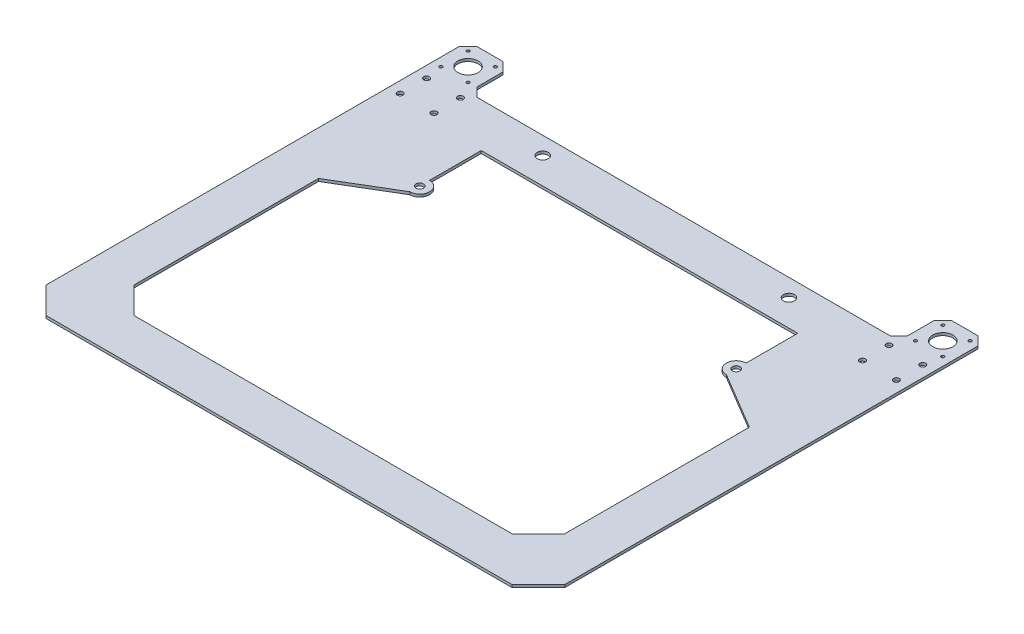
from build123d import *

# Parameters (mm, degrees)
SKETCH1_R           = 6.25
SKETCH1_R_2         = 4.25
SKETCH1_R_3         = 3.25
SKETCH1_R_4         = 11.5
SKETCH1_R_5         = 1.75
BOSS_EXTRUDE1_DEPTH = 3
SKETCH2_W           = 50
SKETCH2_H           = 50
SKETCH2_R           = 11.5
SKETCH2_R_2         = 1.75
BOSS_EXTRUDE2_DEPTH = 3
CHAMFER1_SIZE       = 10
CHAMFER2_SIZE       = 30


with BuildPart() as part:
    # Sketch1 → Boss-Extrude1 (new body)
    with BuildSketch(Plane(origin=(0, 0, 0), x_dir=(1, 0, 0), z_dir=(0, 1, 0))):
        Polygon((-245, 230), (295, 230), (295, -230), (-295, -230), (-295, 230), (-295, 280), (-245, 280), align=None)
        with Locations(Location((-140, 210, 0), (0, 0, 270))):
            Circle(SKETCH1_R, mode=Mode.SUBTRACT)
        with Locations(Location((140, 210, 0), (0, 0, 270))):
            Circle(SKETCH1_R, mode=Mode.SUBTRACT)
        with Locations(Location((-180, 110, 0), (0, 0, 270))):
            Circle(SKETCH1_R_2, mode=Mode.SUBTRACT)
        with Locations(Location((180, 110, 0), (0, 0, 270))):
            Circle(SKETCH1_R_2, mode=Mode.SUBTRACT)
        with Locations(Location((243.695652174, 220, 0), (0, 0, 270))):
            Circle(SKETCH1_R_3, mode=Mode.SUBTRACT)
        with Locations(Location((282.173913043, 220, 0), (0, 0, 270))):
            Circle(SKETCH1_R_3, mode=Mode.SUBTRACT)
        with Locations(Location((282.173913043, 190, 0), (0, 0, 270))):
            Circle(SKETCH1_R_3, mode=Mode.SUBTRACT)
        with Locations(Location((243.695652174, 190, 0), (0, 0, 270))):
            Circle(SKETCH1_R_3, mode=Mode.SUBTRACT)
        with Locations(Location((-282.173913043, 220, 0), (0, 0, 90))):
            Circle(SKETCH1_R_3, mode=Mode.SUBTRACT)
        with Locations(Location((-243.695652174, 220, 0), (0, 0, 90))):
            Circle(SKETCH1_R_3, mode=Mode.SUBTRACT)
        with Locations(Location((-243.695652174, 190, 0), (0, 0, 90))):
            Circle(SKETCH1_R_3, mode=Mode.SUBTRACT)
        with Locations(Location((-282.173913043, 190, 0), (0, 0, 90))):
            Circle(SKETCH1_R_3, mode=Mode.SUBTRACT)
        with Locations(Location((-270, 255, 0), (0, 0, 270))):
            Circle(SKETCH1_R_4, mode=Mode.SUBTRACT)
        with Locations(Location((-285.5, 239.5, 0), (0, 0, 270))):
            Circle(SKETCH1_R_5, mode=Mode.SUBTRACT)
        with Locations(Location((-285.5, 270.5, 0), (0, 0, 270))):
            Circle(SKETCH1_R_5, mode=Mode.SUBTRACT)
        with Locations(Location((-254.5, 270.5, 0), (0, 0, 270))):
            Circle(SKETCH1_R_5, mode=Mode.SUBTRACT)
        with Locations(Location((-254.5, 239.5, 0), (0, 0, 270))):
            Circle(SKETCH1_R_5, mode=Mode.SUBTRACT)
        with BuildLine():
            Line((-180, 180), (180, 180))
            Line((180, 180), (180, 121.25))
            ThreePointArc((180, 121.25), (168.75, 110), (180, 98.75))
            Line((180, 98.75), (245, 60))
            Line((245, 60), (245, -180))
            Line((245, -180), (-245, -180))
            Line((-245, -180), (-245, 60))
            Line((-245, 60), (-180.004119379, 98.750000754))
            ThreePointArc((-180.004119379, 98.750000754), (-168.750000189, 109.997940311), (-180, 121.25))
            Line((-180, 121.25), (-180, 180))
        make_face(mode=Mode.SUBTRACT)
    extrude(amount=BOSS_EXTRUDE1_DEPTH)

    # Sketch2 → Boss-Extrude2 (add)
    with BuildSketch(Plane(origin=(0, 3, 0), x_dir=(1, 0, 0), z_dir=(0, 1, 0))):
        with Locations((270, 255)):
            Rectangle(SKETCH2_W, SKETCH2_H)
        with Locations(Location((270, 255, 0), (0, 0, 270))):
            Circle(SKETCH2_R, mode=Mode.SUBTRACT)
        with Locations(Location((254.5, 270.5, 0), (0, 0, 270))):
            Circle(SKETCH2_R_2, mode=Mode.SUBTRACT)
        with Locations(Location((285.5, 270.5, 0), (0, 0, 270))):
            Circle(SKETCH2_R_2, mode=Mode.SUBTRACT)
        with Locations(Location((254.5, 239.5, 0), (0, 0, 270))):
            Circle(SKETCH2_R_2, mode=Mode.SUBTRACT)
        with Locations(Location((285.5, 239.5, 0), (0, 0, 270))):
            Circle(SKETCH2_R_2, mode=Mode.SUBTRACT)
    extrude(amount=-BOSS_EXTRUDE2_DEPTH)

    # Chamfer1
    chamfer1_edges = [part.edges().sort_by_distance(p)[0] for p in [
        (-295, 1.5, -280),
        (-245, 1.5, -280),
        (-245, 1.5, -230),
        (245, 1.5, -280),
        (245, 1.5, -230),
        (295, 1.5, -280),
    ]]
    chamfer(chamfer1_edges, length=CHAMFER1_SIZE)

    # Chamfer2
    chamfer2_edges = [part.edges().sort_by_distance(p)[0] for p in [
        (295, 1.5, 230),
        (-295, 1.5, 230),
        (245, 1.5, 180),
        (-245, 1.5, 180),
    ]]
    chamfer(chamfer2_edges, length=CHAMFER2_SIZE)


solid = part.part
